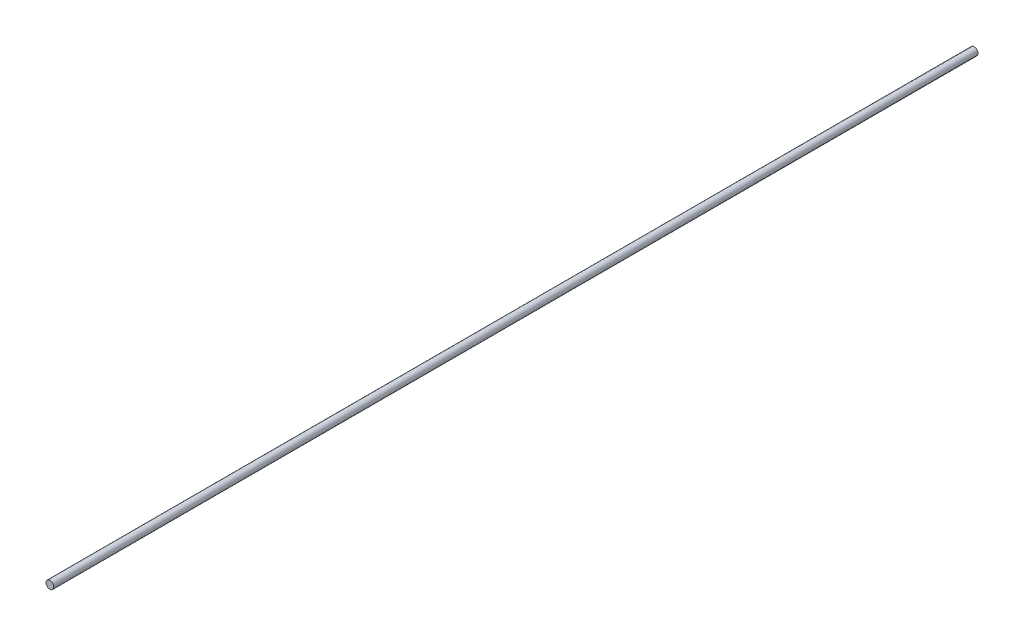
from build123d import *

# Parameters (mm, degrees)
SKETCH1_R           = 6.35
BOSS_EXTRUDE1_DEPTH = 762


with BuildPart() as part:
    # Sketch1 → Boss-Extrude1 (new, symmetric)
    with BuildSketch(Plane.XY):
        Circle(SKETCH1_R)
    extrude(amount=BOSS_EXTRUDE1_DEPTH, both=True)


solid = part.part
